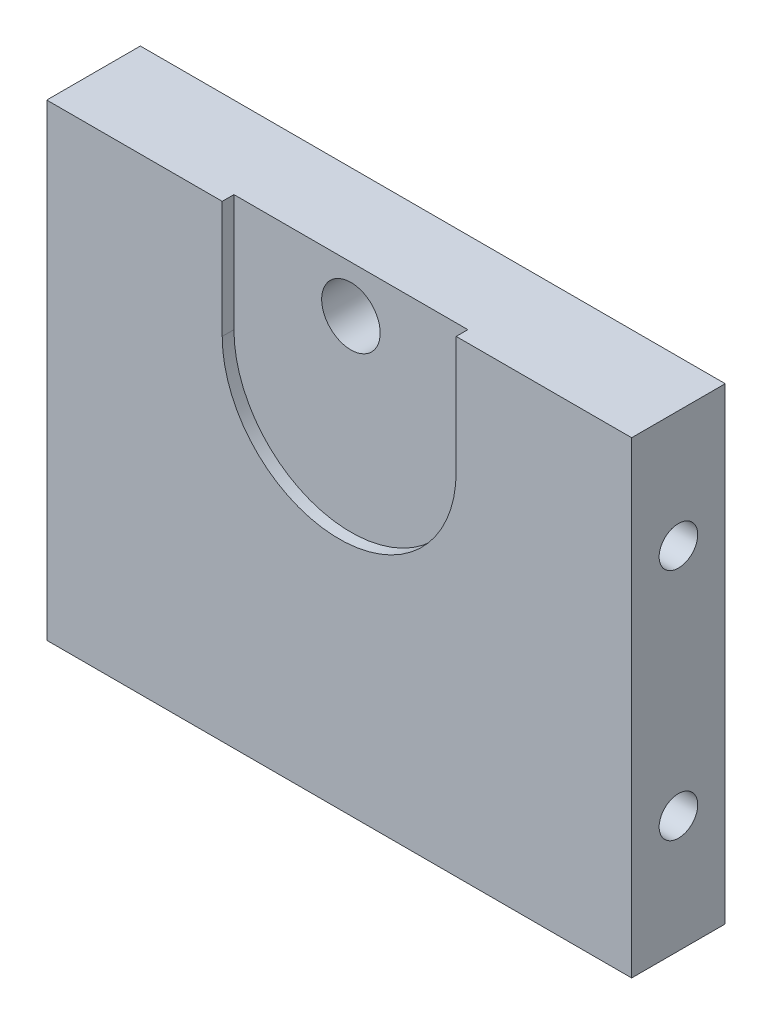
from build123d import *

# Parameters (mm, degrees)
SKETCH_1_W          = 50
SKETCH_1_H          = 40
EXTRUDE_1_DEPTH     = 8
SKETCH_2_R          = 1.65
CUT_EXTRUDE_1_DEPTH = 15
CUT_EXTRUDE_2_DEPTH = 1
SKETCH_5_R          = 2.5
CUT_EXTRUDE_3_DEPTH = 10


with BuildPart() as part:
    # Эскиз1 → Бобышка-Вытянуть1 (new body)
    with BuildSketch(Plane.XY):
        Rectangle(SKETCH_1_W, SKETCH_1_H)
    extrude(amount=EXTRUDE_1_DEPTH)

    # Эскиз2 → Вырез-Вытянуть1 (cut)
    with BuildSketch(Plane(origin=(25, 0, 0), x_dir=(0, 0, -1), z_dir=(1, 0, 0))):
        with Locations(Location((-4, 10, 0), (0, 0, 90))):
            Circle(SKETCH_2_R)
        with Locations(Location((-4, -10, 0), (0, 0, 90))):
            Circle(SKETCH_2_R)
    extrude(amount=-CUT_EXTRUDE_1_DEPTH, mode=Mode.SUBTRACT)

    # Эскиз4 → Вырез-Вытянуть2 (cut)
    with BuildSketch(Plane.XY.offset(8)):
        with BuildLine():
            Line((-10, 20), (10, 20))
            Line((10, 20), (10, 10))
            ThreePointArc((10, 10), (0, 0), (-10, 10))
            Line((-10, 10), (-10, 20))
        make_face()
    extrude(amount=-CUT_EXTRUDE_2_DEPTH, mode=Mode.SUBTRACT)

    # Эскиз5 → Вырез-Вытянуть3 (cut)
    with BuildSketch(Plane.XY.offset(7)):
        with Locations((0, 16)):
            Circle(SKETCH_5_R)
    extrude(amount=-CUT_EXTRUDE_3_DEPTH, mode=Mode.SUBTRACT)


solid = part.part
